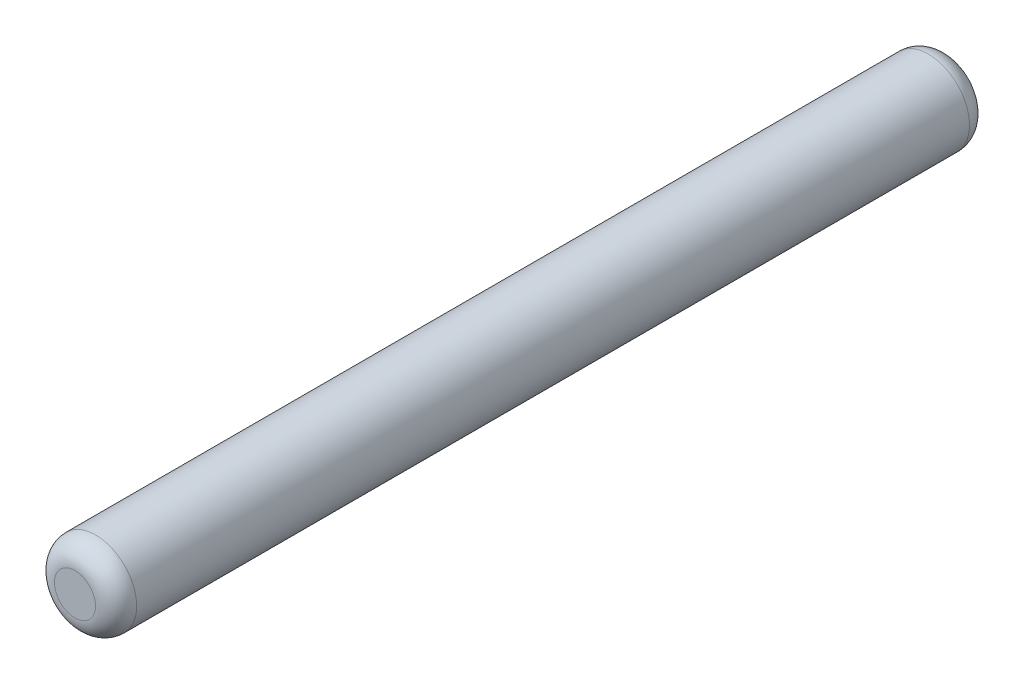
from build123d import *

# Parameters (mm, degrees)
SKETCH_1_R      = 2
EXTRUDE_1_DEPTH = 42.5
FILLET_1_R      = 1


with BuildPart() as part:
    # ｽｹｯﾁ1 → ﾎﾞｽ - 押し出し1 (new body)
    with BuildSketch(Plane.XY):
        Circle(SKETCH_1_R)
    extrude(amount=EXTRUDE_1_DEPTH)

    # ﾌｨﾚｯﾄ1
    fillet_1_edges = [part.edges().sort_by_distance(p)[0] for p in [
        (-2, 0, 0),
        (-2, 0, 42.5),
    ]]
    fillet(fillet_1_edges, radius=FILLET_1_R)


solid = part.part
